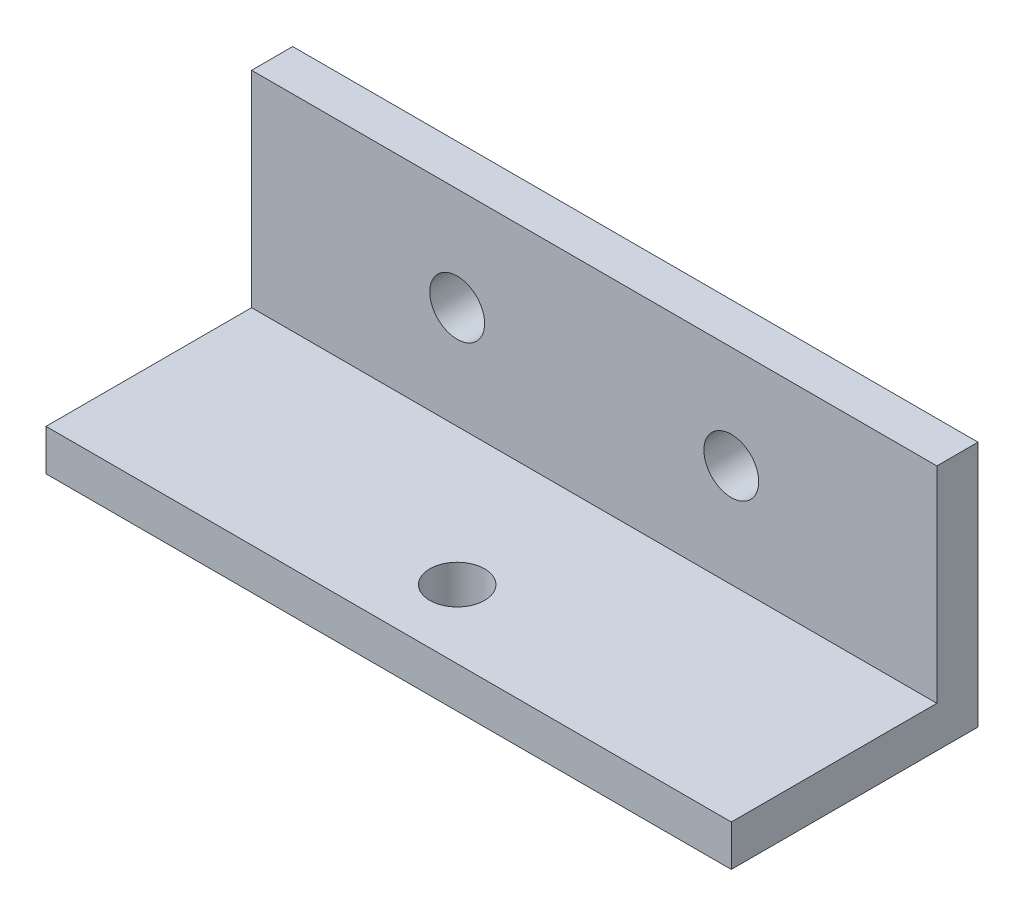
from build123d import *

# Parameters (mm, degrees)
SKETCH1_W           = 50
SKETCH1_H           = 15
SKETCH1_R           = 2
BOSS_EXTRUDE1_DEPTH = 3
SKETCH2_W           = 50
SKETCH2_H           = 3
BOSS_EXTRUDE2_DEPTH = 18
SKETCH3_R           = 2
CUT_EXTRUDE1_DEPTH  = 3


with BuildPart() as part:
    # Sketch1 → Boss-Extrude1 (new body)
    with BuildSketch(Plane(origin=(0, 0, 0), x_dir=(1, 0, 0), z_dir=(0, 1, 0))):
        Rectangle(SKETCH1_W, SKETCH1_H)
        with Locations(Location((0, -2.5, 0), (0, 0, 270))):
            Circle(SKETCH1_R, mode=Mode.SUBTRACT)
    extrude(amount=BOSS_EXTRUDE1_DEPTH)

    # Sketch2 → Boss-Extrude2 (add)
    with BuildSketch(Plane.XZ):
        with Locations((0, -9)):
            Rectangle(SKETCH2_W, SKETCH2_H)
    extrude(amount=-BOSS_EXTRUDE2_DEPTH)

    # Sketch3 → Cut-Extrude1 (cut)
    with BuildSketch(Plane.XY.offset(-7.5)):
        with Locations((-10, 10.5)):
            Circle(SKETCH3_R)
        with Locations(Location((10, 10.5, 0), (0, 0, 180))):
            Circle(SKETCH3_R)
    extrude(amount=-CUT_EXTRUDE1_DEPTH, mode=Mode.SUBTRACT)


solid = part.part
